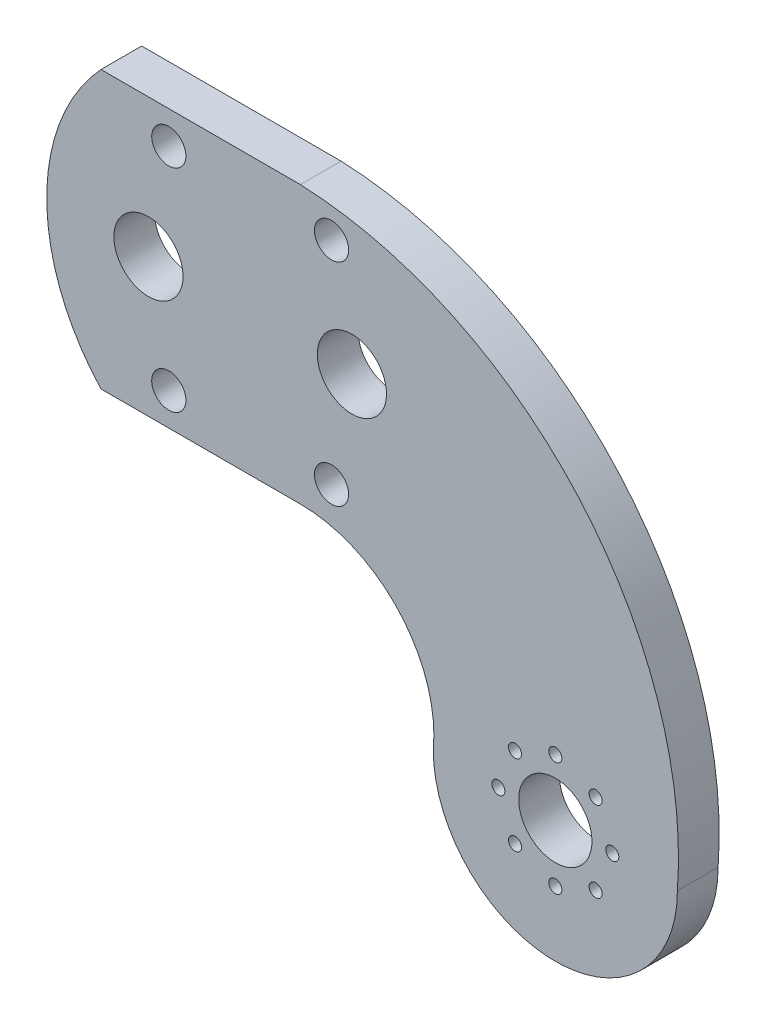
from build123d import *

# Parameters (mm, degrees)
SKETCH1_R           = 2.1
SKETCH1_R_2         = 4.25
BOSS_EXTRUDE1_DEPTH = 5


with BuildPart() as part:
    # Sketch1 → Boss-Extrude1 (new body)
    # profile 1 of 2: a face of its own
    with BuildSketch(Plane.XY):
        with BuildLine():
            Line((-6.331773263, 17), (-30.83030278, 17))
            ThreePointArc((-30.83030278, 17), (-37.5, 0), (-30.83030278, -17))
            Line((-30.83030278, -17), (-6.331773263, -17))
            ThreePointArc((-6.331773263, -17), (5.820650879, -22.382931848), (10, -35))
            ThreePointArc((10, -35), (25, -50), (40, -35))
            ThreePointArc((40, -35), (27.853135577, 0.817900741), (-6.331773263, 17))
        make_face()
        with BuildLine():
            ThreePointArc((34.5, -35), (25, -44.5), (15.5, -35))
            ThreePointArc((15.5, -35), (25, -25.5), (34.5, -35))
        make_face(mode=Mode.SUBTRACT)
        with Locations((-22.5, -13)):
            Circle(SKETCH1_R, mode=Mode.SUBTRACT)
        with Locations((-25, 0)):
            Circle(SKETCH1_R_2, mode=Mode.SUBTRACT)
        with Locations((-2.5, -13)):
            Circle(SKETCH1_R, mode=Mode.SUBTRACT)
        Circle(SKETCH1_R_2, mode=Mode.SUBTRACT)
        with Locations((-22.5, 13)):
            Circle(SKETCH1_R, mode=Mode.SUBTRACT)
        with Locations((-2.5, 13)):
            Circle(SKETCH1_R, mode=Mode.SUBTRACT)
    # profile 2 of 2: a face of its own
    with BuildSketch(Plane.XY):
        with BuildLine():
            ThreePointArc((15.5, -35), (25, -44.5), (34.5, -35))
            ThreePointArc((34.5, -35), (25, -25.5), (15.5, -35))
        make_face()
        with BuildLine():
            ThreePointArc((24.2, -28), (25, -28.8), (25.8, -28))
            ThreePointArc((25.8, -28), (25, -27.2), (24.2, -28))
        make_face(mode=Mode.SUBTRACT)
        with BuildLine():
            ThreePointArc((30.749747468, -30.050252532), (29.949747468, -29.250252532), (29.149747468, -30.050252532))
            ThreePointArc((29.149747468, -30.050252532), (29.949747468, -30.850252532), (30.749747468, -30.050252532))
        make_face(mode=Mode.SUBTRACT)
        with BuildLine():
            ThreePointArc((32.8, -35), (32, -34.2), (31.2, -35))
            ThreePointArc((31.2, -35), (32, -35.8), (32.8, -35))
        make_face(mode=Mode.SUBTRACT)
        with BuildLine():
            ThreePointArc((30.749747468, -39.949747468), (29.949747468, -39.149747468), (29.149747468, -39.949747468))
            ThreePointArc((29.149747468, -39.949747468), (29.949747468, -40.749747468), (30.749747468, -39.949747468))
        make_face(mode=Mode.SUBTRACT)
        with BuildLine():
            ThreePointArc((25.8, -42), (25, -41.2), (24.2, -42))
            ThreePointArc((24.2, -42), (25, -42.8), (25.8, -42))
        make_face(mode=Mode.SUBTRACT)
        with BuildLine():
            ThreePointArc((19.250252532, -39.949747468), (20.050252532, -40.749747468), (20.850252532, -39.949747468))
            ThreePointArc((20.850252532, -39.949747468), (20.050252532, -39.149747468), (19.250252532, -39.949747468))
        make_face(mode=Mode.SUBTRACT)
        with BuildLine():
            ThreePointArc((17.2, -35), (18, -35.8), (18.8, -35))
            ThreePointArc((18.8, -35), (18, -34.2), (17.2, -35))
        make_face(mode=Mode.SUBTRACT)
        with BuildLine():
            ThreePointArc((19.250252532, -30.050252532), (20.050252532, -30.850252532), (20.850252532, -30.050252532))
            ThreePointArc((20.850252532, -30.050252532), (20.050252532, -29.250252532), (19.250252532, -30.050252532))
        make_face(mode=Mode.SUBTRACT)
        with BuildLine():
            ThreePointArc((29.5, -35), (25, -30.5), (20.5, -35))
            ThreePointArc((20.5, -35), (25, -39.5), (29.5, -35))
        make_face(mode=Mode.SUBTRACT)
    extrude(amount=BOSS_EXTRUDE1_DEPTH)


solid = part.part
